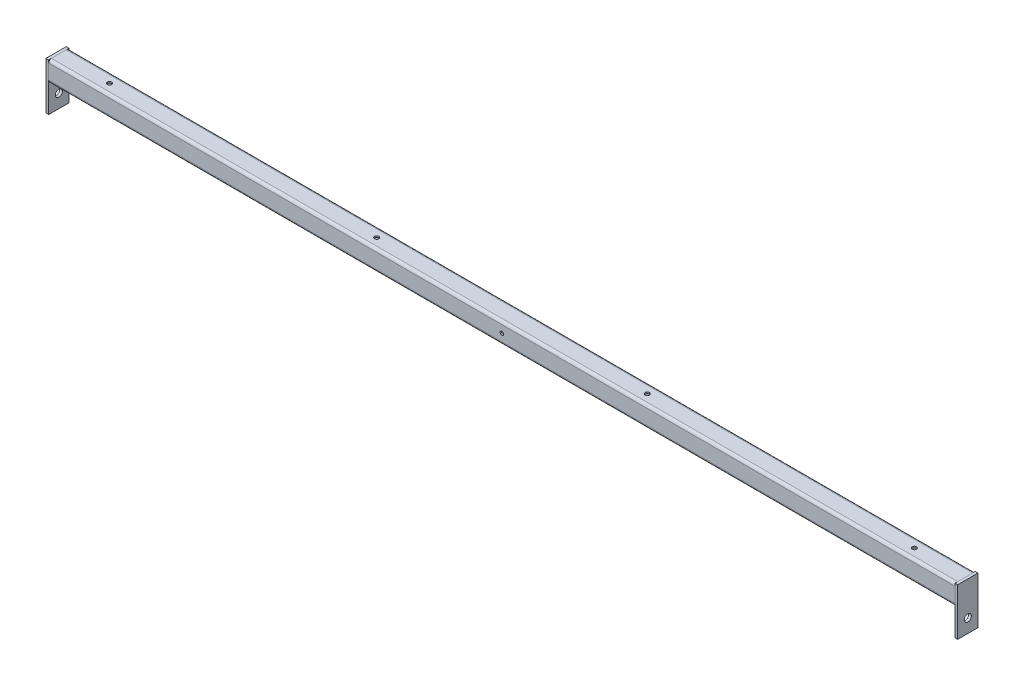
from build123d import *

# Parameters (mm, degrees)
SQUARE_TUBE_CONFIGURED_30_X_30_X_2_DEPTH = 1344
SKETCH11_W                               = 4
SKETCH11_H                               = 30
STEEL_BAR_CONFIGURED_30_X_2_DEPTH        = 70
SKETCH11_ON_SEGMENT_2_W                  = 4
SKETCH11_ON_SEGMENT_2_H                  = 30
STEEL_BAR_CONFIGURED_30_X_2_2_DEPTH      = 70
SKETCH13_W                               = 5.25
SKETCH13_H                               = 1348
SKETCH18_W                               = 2.6
SKETCH18_H                               = 30
SKETCH22_W                               = 3.2
SKETCH22_H                               = 70
M6_CLEARANCE_HOLE_TABLE_MOUNT_AT_2_COUNT = 2
M6_CLEARANCE_HOLE_TABLE_MOUNT_AT_2_PITCH = 395
M6_CLEARANCE_HOLE_TABLE_MOUNT_AT_3_COUNT = 2
M6_CLEARANCE_HOLE_TABLE_MOUNT_AT_3_PITCH = 795
M6_CLEARANCE_HOLE_TABLE_MOUNT_AT_4_COUNT = 2
M6_CLEARANCE_HOLE_TABLE_MOUNT_AT_4_PITCH = 1190


with BuildPart() as part:
    # Sketch1 → Square tube - configured 30 X 30 X 2 (new body)
    with BuildSketch(Plane(origin=(0, 55, 0), x_dir=(0, 0, -1), z_dir=(1, 0, 0))):
        with BuildLine():
            Line((-11, -15), (11, -15))
            ThreePointArc((11, -15), (13.828427125, -13.828427125), (15, -11))
            Line((15, -11), (15, 11))
            ThreePointArc((15, 11), (13.828427125, 13.828427125), (11, 15))
            Line((11, 15), (-11, 15))
            ThreePointArc((-11, 15), (-13.828427125, 13.828427125), (-15, 11))
            Line((-15, 11), (-15, -11))
            ThreePointArc((-15, -11), (-13.828427125, -13.828427125), (-11, -15))
        make_face()
        with BuildLine():
            Line((-11, -13), (11, -13))
            ThreePointArc((11, -13), (12.414213562, -12.414213562), (13, -11))
            Line((13, -11), (13, 11))
            ThreePointArc((13, 11), (12.414213562, 12.414213562), (11, 13))
            Line((11, 13), (-11, 13))
            ThreePointArc((-11, 13), (-12.414213562, 12.414213562), (-13, 11))
            Line((-13, 11), (-13, -11))
            ThreePointArc((-13, -11), (-12.414213562, -12.414213562), (-11, -13))
        make_face(mode=Mode.SUBTRACT)
    extrude(amount=SQUARE_TUBE_CONFIGURED_30_X_30_X_2_DEPTH)

    # Trim/Extend1
    split(bisect_by=Plane(origin=(1342, 35, 0), x_dir=(0, -1, 0), z_dir=(-1, 0, 0)), keep=Keep.TOP)

    # Trim_Extend1 3
    split(bisect_by=Plane(origin=(2, 35, 0), x_dir=(0, 1, 0), z_dir=(1, 0, 0)), keep=Keep.TOP)

    # Sketch18 → Ø5.2 (5.2) Wall Mount Hole (revolve, cut)
    with BuildSketch(Plane(origin=(672, 55, 15), x_dir=(0, -1, 0), z_dir=(1, 0, 0))):
        with Locations((1.3, 15)):
            Rectangle(SKETCH18_W, SKETCH18_H)
    revolve(axis=Axis((672, 55, 21.35), (0, 0, -1)), mode=Mode.SUBTRACT)

    # Sketch22 → M6 Clearance Hole table mount (revolve, cut)
    with BuildSketch(Plane(origin=(77, 70, 0), x_dir=(0, 0, 1), z_dir=(1, 0, 0))):
        with Locations((1.6, 35)):
            Rectangle(SKETCH22_W, SKETCH22_H)
    m6_clearance_hole_table_mount = revolve(axis=Axis((77, 76.35, 0), (0, -1, 0)), mode=Mode.SUBTRACT)

    # M6 Clearance Hole table mount at 2: M6 Clearance Hole table mount ×2
    with Locations(*[(i * M6_CLEARANCE_HOLE_TABLE_MOUNT_AT_2_PITCH, 0, 0) for i in range(1, M6_CLEARANCE_HOLE_TABLE_MOUNT_AT_2_COUNT)]):
        add(m6_clearance_hole_table_mount, mode=Mode.SUBTRACT)

    # M6 Clearance Hole table mount at 3: M6 Clearance Hole table mount ×2
    with Locations(*[(i * M6_CLEARANCE_HOLE_TABLE_MOUNT_AT_3_PITCH, 0, 0) for i in range(1, M6_CLEARANCE_HOLE_TABLE_MOUNT_AT_3_COUNT)]):
        add(m6_clearance_hole_table_mount, mode=Mode.SUBTRACT)

    # M6 Clearance Hole table mount at 4: M6 Clearance Hole table mount ×2
    with Locations(*[(i * M6_CLEARANCE_HOLE_TABLE_MOUNT_AT_4_PITCH, 0, 0) for i in range(1, M6_CLEARANCE_HOLE_TABLE_MOUNT_AT_4_COUNT)]):
        add(m6_clearance_hole_table_mount, mode=Mode.SUBTRACT)


with BuildPart() as body_2:
    # Sketch11 → Steel bar - configured 30 X 2 (new body)
    with BuildSketch(Plane(origin=(0, 0, 0), x_dir=(1, 0, 0), z_dir=(0, 1, 0))):
        Rectangle(SKETCH11_W, SKETCH11_H)
    extrude(amount=STEEL_BAR_CONFIGURED_30_X_2_DEPTH)


with BuildPart() as body_3:
    # Sketch11 on segment 2 (carried to segment 2) → Steel bar - configured 30 X 2 2 (new body)
    with BuildSketch(Plane(origin=(1344, 0, 0), x_dir=(1, 0, 0), z_dir=(0, 1, 0))):
        Rectangle(SKETCH11_ON_SEGMENT_2_W, SKETCH11_ON_SEGMENT_2_H)
    extrude(amount=STEEL_BAR_CONFIGURED_30_X_2_2_DEPTH)


with BuildPart() as f_10_5_10_5_frame_mount_holes_tool:
    # Sketch13 → Ø10.5 (10.5) Frame Mount Holes (revolve)
    with BuildSketch(Plane(origin=(1346, 20, 0), x_dir=(0, 0, -1), z_dir=(0, 1, 0))):
        with Locations((2.625, 674)):
            Rectangle(SKETCH13_W, SKETCH13_H)
    revolve(axis=Axis((1352.35, 20, 0), (-1, 0, 0)))


with BuildPart() as body_2_1:
    add(body_2.part)

    # Ø10.5 (10.5) Frame Mount Holes: cut by f_10_5_10_5_frame_mount_holes_tool
    add(f_10_5_10_5_frame_mount_holes_tool.part, mode=Mode.SUBTRACT)


with BuildPart() as body_3_1:
    add(body_3.part)

    # Ø10.5 (10.5) Frame Mount Holes: cut by f_10_5_10_5_frame_mount_holes_tool
    add(f_10_5_10_5_frame_mount_holes_tool.part, mode=Mode.SUBTRACT)


solid = Compound([part.part, body_2_1.part, body_3_1.part])
